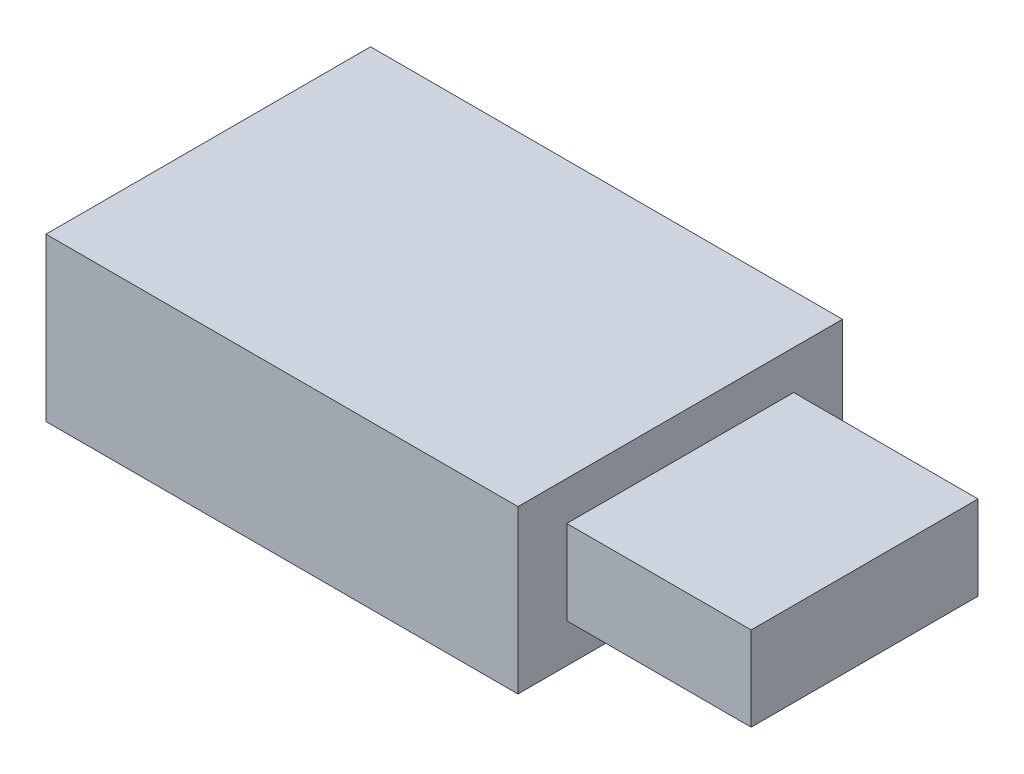
from build123d import *

# Parameters (mm, degrees)
SKETCH1_W           = 24.9682
SKETCH1_H           = 17.1704
BOSS_EXTRUDE1_DEPTH = 4.2926
SKETCH3_W           = 12.0015
SKETCH3_H           = 4.4577
BOSS_EXTRUDE2_DEPTH = 9.7536
SKETCH4_R           = 1.27
BOSS_EXTRUDE3_DEPTH = 2.54


with BuildPart() as part:
    # Sketch1 → Boss-Extrude1 (new, symmetric)
    with BuildSketch(Plane(origin=(0, 0, 0), x_dir=(1, 0, 0), z_dir=(0, 1, 0))):
        Rectangle(SKETCH1_W, SKETCH1_H)
    extrude(amount=BOSS_EXTRUDE1_DEPTH, both=True)

    # Sketch3 → Boss-Extrude2 (add)
    with BuildSketch(Plane(origin=(12.4841, 0, 0), x_dir=(0, 0, -1), z_dir=(1, 0, 0))):
        Rectangle(SKETCH3_W, SKETCH3_H)
    extrude(amount=BOSS_EXTRUDE2_DEPTH)

    # Sketch4 → Boss-Extrude3 (add)
    with BuildSketch(Plane.ZY.offset(12.4841)):
        with Locations(Location((0, 0, 0), (0, 0, 180))):
            Circle(SKETCH4_R)
    extrude(amount=BOSS_EXTRUDE3_DEPTH)


solid = part.part
